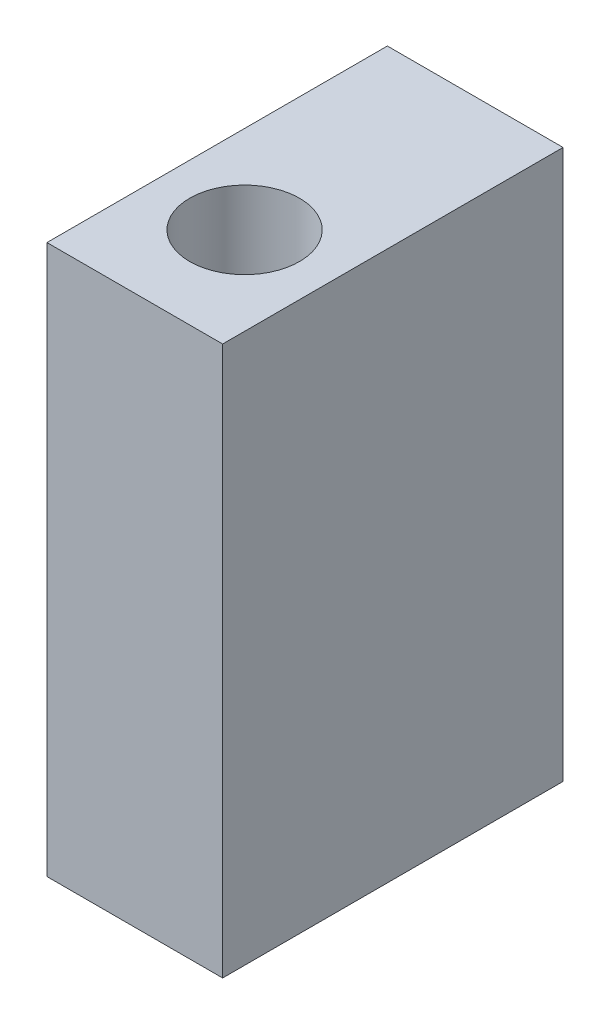
from build123d import *

# Parameters (mm, degrees)
SKETCH1_W           = 16
SKETCH1_H           = 31
BOSS_EXTRUDE1_DEPTH = 50
SKETCH2_R           = 5
CUT_EXTRUDE1_DEPTH  = 53.955169719


with BuildPart() as part:
    # Sketch1 → Boss-Extrude1 (new body)
    with BuildSketch(Plane(origin=(0, 0, 0), x_dir=(1, 0, 0), z_dir=(0, 1, 0))):
        Rectangle(SKETCH1_W, SKETCH1_H)
    extrude(amount=BOSS_EXTRUDE1_DEPTH)

    # Sketch2 → Cut-Extrude1 (cut, through all)
    with BuildSketch(Plane(origin=(0, 50, 0), x_dir=(1, 0, 0), z_dir=(0, 1, 0))):
        with Locations(Location((0, -5.5, 0), (0, 0, 270))):
            Circle(SKETCH2_R)
    extrude(amount=-CUT_EXTRUDE1_DEPTH, mode=Mode.SUBTRACT)


solid = part.part
